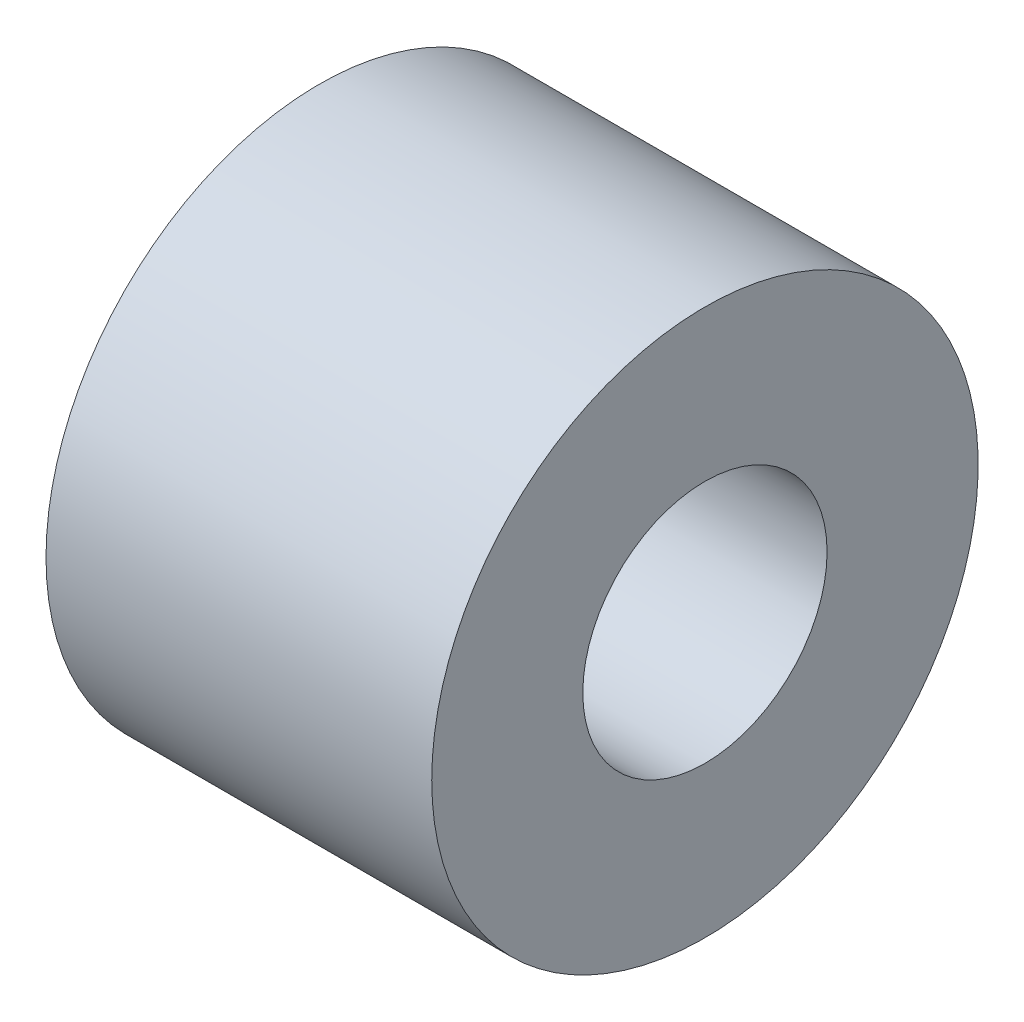
from build123d import *

# Parameters (mm, degrees)
SKETCH1_R           = 5.3975
SKETCH1_R_2         = 2.413
BOSS_EXTRUDE1_DEPTH = 3.81


with BuildPart() as part:
    # Sketch1 → Boss-Extrude1 (new, symmetric)
    with BuildSketch(Plane(origin=(0, 0, 0), x_dir=(0, 0, -1), z_dir=(1, 0, 0))):
        with Locations(Location((0, 0, 0), (0, 0, 180))):
            Circle(SKETCH1_R)
        with Locations(Location((0, 0, 0), (0, 0, 180))):
            Circle(SKETCH1_R_2, mode=Mode.SUBTRACT)
    extrude(amount=BOSS_EXTRUDE1_DEPTH, both=True)


solid = part.part
